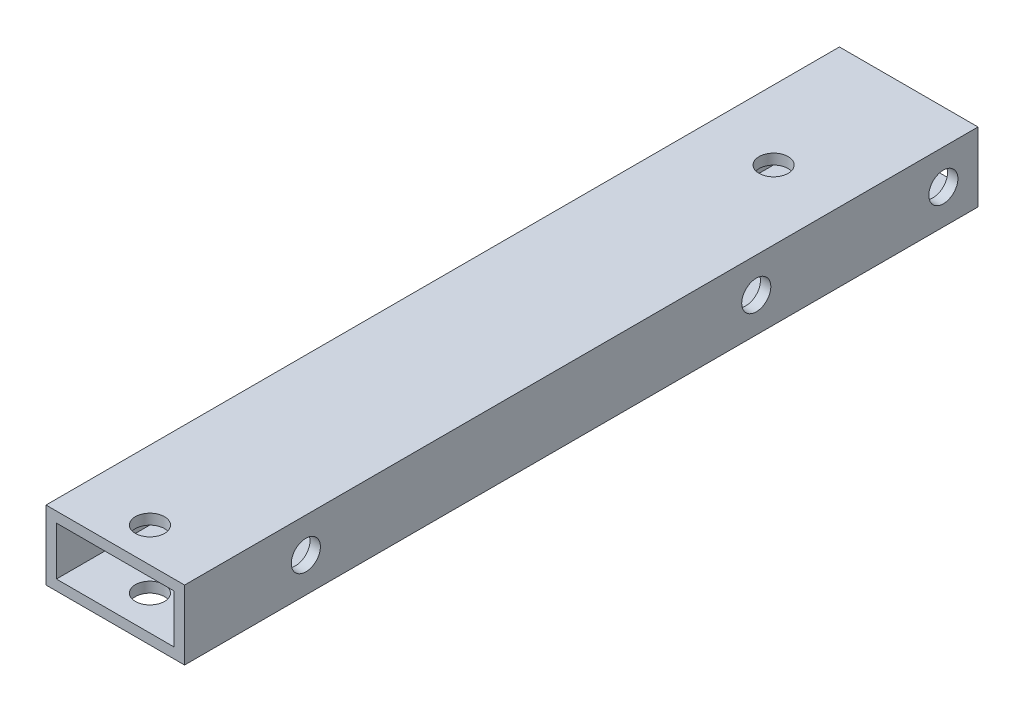
from build123d import *

# Parameters (mm, degrees)
SKETCH_1_W          = 20
SKETCH_1_H          = 10
SKETCH_1_W_2        = 17
SKETCH_1_H_2        = 7
EXTRUDE_1_DEPTH     = 114.5
SKETCH_2_R          = 2.1
CUT_EXTRUDE_1_DEPTH = 117.341093342
SKETCH_3_R          = 2.1
CUT_EXTRUDE_2_DEPTH = 117.341093342
SKETCH_4_R          = 2.1
CUT_EXTRUDE_3_DEPTH = 116.370056774


with BuildPart() as part:
    # ｽｹｯﾁ1 → 押し出し-薄板1 (new body)
    with BuildSketch(Plane.XY):
        Rectangle(SKETCH_1_W, SKETCH_1_H)
        Rectangle(SKETCH_1_W_2, SKETCH_1_H_2, mode=Mode.SUBTRACT)
    extrude(amount=EXTRUDE_1_DEPTH)

    # ｽｹｯﾁ2 → ｶｯﾄ - 押し出し1 (cut, through all)
    with BuildSketch(Plane(origin=(10, 0, 0), x_dir=(0, 0, -1), z_dir=(1, 0, 0))):
        with Locations(Location((-97, 0, 0), (0, 0, 90))):
            Circle(SKETCH_2_R)
        with Locations(Location((-32, 0, 0), (0, 0, 90))):
            Circle(SKETCH_2_R)
    extrude(amount=-CUT_EXTRUDE_1_DEPTH, mode=Mode.SUBTRACT)

    # ｽｹｯﾁ3 → ｶｯﾄ - 押し出し2 (cut, through all)
    with BuildSketch(Plane(origin=(10, 0, 0), x_dir=(0, 0, -1), z_dir=(1, 0, 0))):
        with Locations(Location((-5, 0, 0), (0, 0, 90))):
            Circle(SKETCH_3_R)
    extrude(amount=-CUT_EXTRUDE_2_DEPTH, mode=Mode.SUBTRACT)

    # ｽｹｯﾁ4 → ｶｯﾄ - 押し出し3 (cut, through all)
    with BuildSketch(Plane(origin=(0, 5, 0), x_dir=(1, 0, 0), z_dir=(0, 1, 0))):
        with Locations(Location((0, -19.5, 0), (0, 0, 270))):
            Circle(SKETCH_4_R)
        with Locations(Location((0, -109.5, 0), (0, 0, 270))):
            Circle(SKETCH_4_R)
    extrude(amount=-CUT_EXTRUDE_3_DEPTH, mode=Mode.SUBTRACT)


solid = part.part
